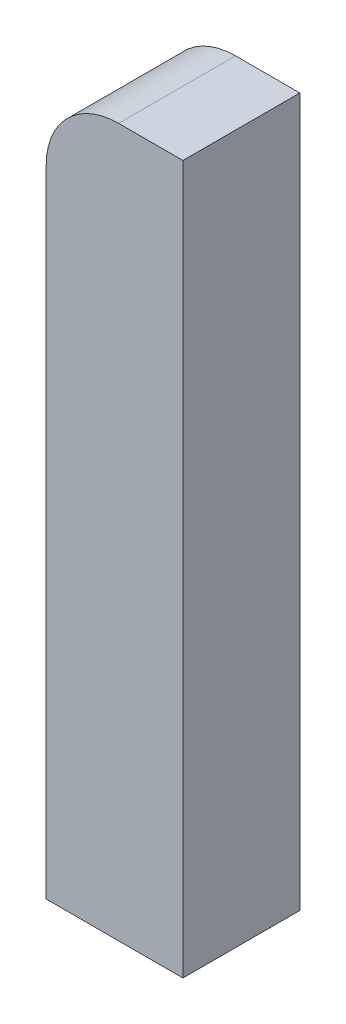
from build123d import *

# Parameters (mm, degrees)
SKETCH1_R           = 1.7
BOSS_EXTRUDE3_DEPTH = 16.141
CUT_EXTRUDE1_DEPTH  = 152.557838009
FILLET1_R           = 10


with BuildPart() as part:
    # Sketch1 → Boss-Extrude3 (new body)
    with BuildSketch(Plane.XY):
        Polygon((0, 0), (37.75, 0), (37.75, 29.178), (28.3125, 48.144), (28.3125, 145.891), (9.4375, 145.891), (9.4375, 48.144), (0, 29.178), align=None)
        with Locations((5.6625, 8.494)):
            Circle(SKETCH1_R, mode=Mode.SUBTRACT)
        with Locations((32.0875, 8.494)):
            Circle(SKETCH1_R, mode=Mode.SUBTRACT)
    extrude(amount=BOSS_EXTRUDE3_DEPTH)

    # Sketch2 → Cut-Extrude1 (cut, through all)
    with BuildSketch(Plane.XY.offset(16.141)):
        Polygon((9.4375, 48.144), (28.3125, 48.144), (37.75, 29.178), (37.75, 0), (0, 0), (0, 29.178), align=None)
    extrude(amount=-CUT_EXTRUDE1_DEPTH, mode=Mode.SUBTRACT)

    # Fillet1
    fillet1_edges = [part.edges().sort_by_distance(p)[0] for p in [
        (9.4375, 145.891, 8.0705),
    ]]
    fillet(fillet1_edges, radius=FILLET1_R)


solid = part.part
